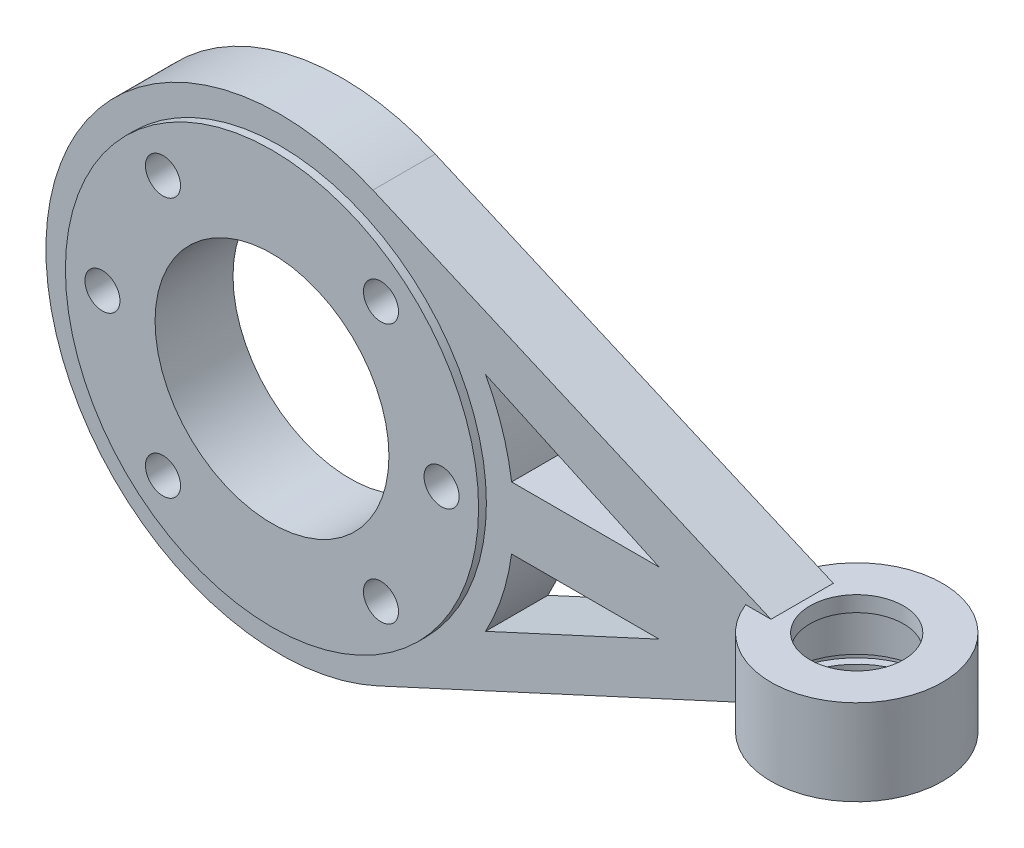
from build123d import *

# Parameters (mm, degrees)
SKETCH_1_R               = 30
EXTRUDE_1_DEPTH          = 3
SKETCH_2_W               = 11
SKETCH_2_H               = 11
EXTRUDE_2_DEPTH          = 4
SKETCH_4_R               = 6
CUT_EXTRUDE_1_DEPTH      = 25
SKETCH_5_R               = 9
CUT_EXTRUDE_2_DEPTH      = 9
CUT_EXTRUDE_START        = 7.85
SKETCH_6_R               = 10
SKETCH_6_R_2             = 9
CUT_EXTRUDE_3_DEPTH      = 1.1
SKETCH_8_R               = 26.5
EXTRUDE_3_DEPTH          = 5
CUT_EXTRUDE_4_DEPTH      = 88.669835177
CUT_EXTRUDE_4_DEPTH_BACK = 88.669835177
SKETCH_7_R               = 15
SKETCH_10_R              = 2.25
CUT_EXTRUDE_5_DEPTH      = 17


with BuildPart() as part:
    # 草图1 → 凸台-拉伸1 (new body)
    with BuildSketch(Plane.XY):
        Circle(SKETCH_1_R)
    extrude(amount=EXTRUDE_1_DEPTH)



with BuildPart() as body_2:
    # 草图2 → 旋转1 (revolve)
    with BuildSketch(Plane.XY.offset(3), mode=Mode.PRIVATE) as revolve_1_sk:
        with Locations((64.5, -0.125)):
            Rectangle(SKETCH_2_W, SKETCH_2_H)
    revolve(revolve_1_sk.sketch.rotate(Axis((70, 22.717290725, 3), (0, -1, 0)), 270), axis=Axis((70, 22.717290725, 3), (0, -1, 0)))


with BuildPart() as part_1:
    add(part.part)

    add(body_2.part)  # 凸台-拉伸2 merges body 2
    # 草图3 → 凸台-拉伸2 (add, symmetric)
    with BuildSketch(Plane.XY.offset(3)):
        with BuildLine():
            Line((11.937553945, 27.522623527), (63, 5.375))
            Line((63, 5.375), (63, -4))
            Line((63, -4), (12.555800964, -27.246134811))
            ThreePointArc((12.555800964, -27.246134811), (-29.998088792, -0.338627888), (11.937553945, 27.522623527))
        make_face()
    extrude(amount=EXTRUDE_2_DEPTH, both=True)

    # 草图4 → 切除-拉伸1 (cut)
    with BuildSketch(Plane.XZ.offset(5.625)):
        with Locations(Location((70, 3, 0), (0, 0, 270))):
            Circle(SKETCH_4_R)
    extrude(amount=-CUT_EXTRUDE_1_DEPTH, mode=Mode.SUBTRACT)

    # 草图5 → 切除-拉伸2 (cut)
    with BuildSketch(Plane.XZ.offset(5.625)):
        with Locations(Location((70, 3, 0), (0, 0, 270))):
            Circle(SKETCH_5_R)
    extrude(amount=-CUT_EXTRUDE_2_DEPTH, mode=Mode.SUBTRACT)

    # 草图6 → 切除-拉伸3 (cut)
    # profile 1 of 2: a face of its own
    with BuildSketch(Plane.XZ.offset(-3.375).offset(CUT_EXTRUDE_START)):
        with Locations(Location((70, 3, 0), (0, 0, 270))):
            Circle(SKETCH_6_R)
        with Locations(Location((70, 3, 0), (0, 0, 270))):
            Circle(SKETCH_6_R_2, mode=Mode.SUBTRACT)
    # profile 2 of 2: a face of its own
    with BuildSketch(Plane.XZ.offset(-3.375).offset(CUT_EXTRUDE_START)):
        with Locations(Location((70, 3, 0), (0, 0, 270))):
            Circle(SKETCH_6_R_2)
    extrude(amount=-CUT_EXTRUDE_3_DEPTH, mode=Mode.SUBTRACT)

    # 草图8 → 凸台-拉伸3 (add, symmetric)
    with BuildSketch(Plane(origin=(0, 0, 3), x_dir=(-1, 0, 0), z_dir=(0, 0, -1))):
        with Locations(Location((0, 0, 0), (0, 0, 180))):
            Circle(SKETCH_8_R)
    extrude(amount=EXTRUDE_3_DEPTH, both=True)

    # 草图7 → 切除-拉伸4 (cut, two sides: drawn at the far end of the back side and taken through both)
    with BuildSketch(Plane.XY.offset(7).offset(-CUT_EXTRUDE_4_DEPTH_BACK)):
        with Locations(Location((0, 0, 0), (0, 0, 180))):
            Circle(SKETCH_7_R)
        with BuildLine():
            Line((26.392321658, -14.26342727), (48.663997023, -4))
            Line((48.663997023, -4), (29.732137495, -4))
            ThreePointArc((29.732137495, -4), (28.527586888, -9.283145284), (26.392321658, -14.26342727))
        make_face()
        with BuildLine():
            Line((29.732137495, 4), (48.663997023, 4))
            Line((48.663997023, 4), (26.392321658, 14.26342727))
            ThreePointArc((26.392321658, 14.26342727), (28.527586888, 9.283145284), (29.732137495, 4))
        make_face()
    extrude(amount=CUT_EXTRUDE_4_DEPTH + CUT_EXTRUDE_4_DEPTH_BACK, mode=Mode.SUBTRACT)

    # 草图10 → 切除-拉伸5 (cut)
    with BuildSketch(Plane.XY.offset(8)):
        with Locations((21.75, 0)):
            Circle(SKETCH_10_R)
        with Locations((13.980630511, -16.661466638)):
            Circle(SKETCH_10_R)
        with Locations(Location((-21.75, 0, 0), (0, 0, 180))):
            Circle(SKETCH_10_R)
        with Locations(Location((-13.980630511, -16.661466638, 0), (0, 0, 180))):
            Circle(SKETCH_10_R)
        with Locations(Location((13.980630511, 16.661466638, 0), (0, 0, 180))):
            Circle(SKETCH_10_R)
        with Locations((-13.980630511, 16.661466638)):
            Circle(SKETCH_10_R)
    extrude(amount=-CUT_EXTRUDE_5_DEPTH, mode=Mode.SUBTRACT)


solid = part_1.part
